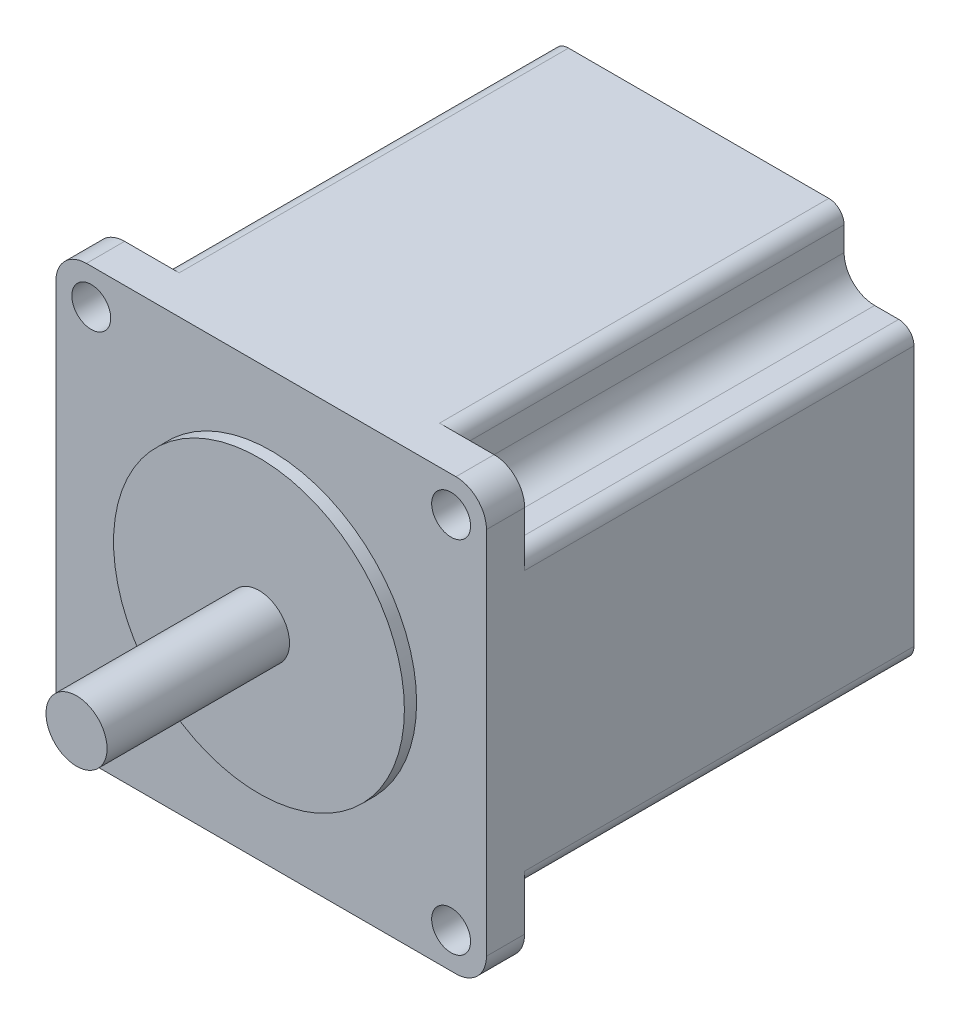
from build123d import *

# Parameters (mm, degrees)
SKETCH1_W           = 56.4
SKETCH1_H           = 56.4
BOSS_EXTRUDE1_DEPTH = 56
SKETCH2_R           = 2.55
CUT_EXTRUDE1_DEPTH  = 6
SKETCH3_R           = 19.05
BOSS_EXTRUDE2_DEPTH = 1.6
SKETCH4_R           = 4
BOSS_EXTRUDE3_DEPTH = 23.9
FILLET1_R           = 4
SKETCH5_W           = 9.15
SKETCH5_H           = 9.15
CUT_EXTRUDE2_DEPTH  = 51
FILLET3_R           = 4
FILLET4_R           = 2


with BuildPart() as part:
    # Sketch1 → Boss-Extrude1 (new body)
    with BuildSketch(Plane.XY):
        Rectangle(SKETCH1_W, SKETCH1_H)
    extrude(amount=-BOSS_EXTRUDE1_DEPTH)

    # Sketch2 → Cut-Extrude1 (cut)
    with BuildSketch(Plane.XY):
        with Locations((-23.57, 23.57)):
            Circle(SKETCH2_R)
        with Locations((23.57, 23.57)):
            Circle(SKETCH2_R)
        with Locations((23.57, -23.57)):
            Circle(SKETCH2_R)
        with Locations((-23.57, -23.57)):
            Circle(SKETCH2_R)
    extrude(amount=-CUT_EXTRUDE1_DEPTH, mode=Mode.SUBTRACT)

    # Sketch3 → Boss-Extrude2 (add)
    with BuildSketch(Plane.XY):
        Circle(SKETCH3_R)
    extrude(amount=BOSS_EXTRUDE2_DEPTH)

    # Sketch4 → Boss-Extrude3 (add)
    with BuildSketch(Plane.XY.offset(1.6)):
        Circle(SKETCH4_R)
    extrude(amount=BOSS_EXTRUDE3_DEPTH)

    # Fillet1
    fillet1_edges = [part.edges().sort_by_distance(p)[0] for p in [
        (28.2, -28.2, -28),
        (-28.2, -28.2, -28),
        (-28.2, 28.2, -28),
        (28.2, 28.2, -28),
    ]]
    fillet(fillet1_edges, radius=FILLET1_R)

    # Sketch5 → Cut-Extrude2 (cut)
    with BuildSketch(Plane(origin=(0, 0, -56), x_dir=(-1, 0, 0), z_dir=(0, 0, -1))):
        with Locations((-23.625, 23.625)):
            Rectangle(SKETCH5_W, SKETCH5_H)
        with Locations((23.625, 23.625)):
            Rectangle(SKETCH5_W, SKETCH5_H)
        with Locations((23.625, -23.625)):
            Rectangle(SKETCH5_W, SKETCH5_H)
        with Locations((-23.625, -23.625)):
            Rectangle(SKETCH5_W, SKETCH5_H)
    extrude(amount=-CUT_EXTRUDE2_DEPTH, mode=Mode.SUBTRACT)

    # Fillet3
    fillet3_edges = [part.edges().sort_by_distance(p)[0] for p in [
        (-19.05, 19.05, -30.5),
        (19.05, 19.05, -30.5),
        (19.05, -19.05, -30.5),
        (-19.05, -19.05, -30.5),
    ]]
    fillet(fillet3_edges, radius=FILLET3_R)

    # Fillet4
    fillet4_edges = [part.edges().sort_by_distance(p)[0] for p in [
        (-28.2, 19.05, -30.5),
        (-19.05, 28.2, -30.5),
        (28.2, 19.05, -30.5),
        (19.05, 28.2, -30.5),
        (28.2, -19.05, -30.5),
        (19.05, -28.2, -30.5),
        (-28.2, -19.05, -30.5),
        (-19.05, -28.2, -30.5),
    ]]
    fillet(fillet4_edges, radius=FILLET4_R)


solid = part.part
